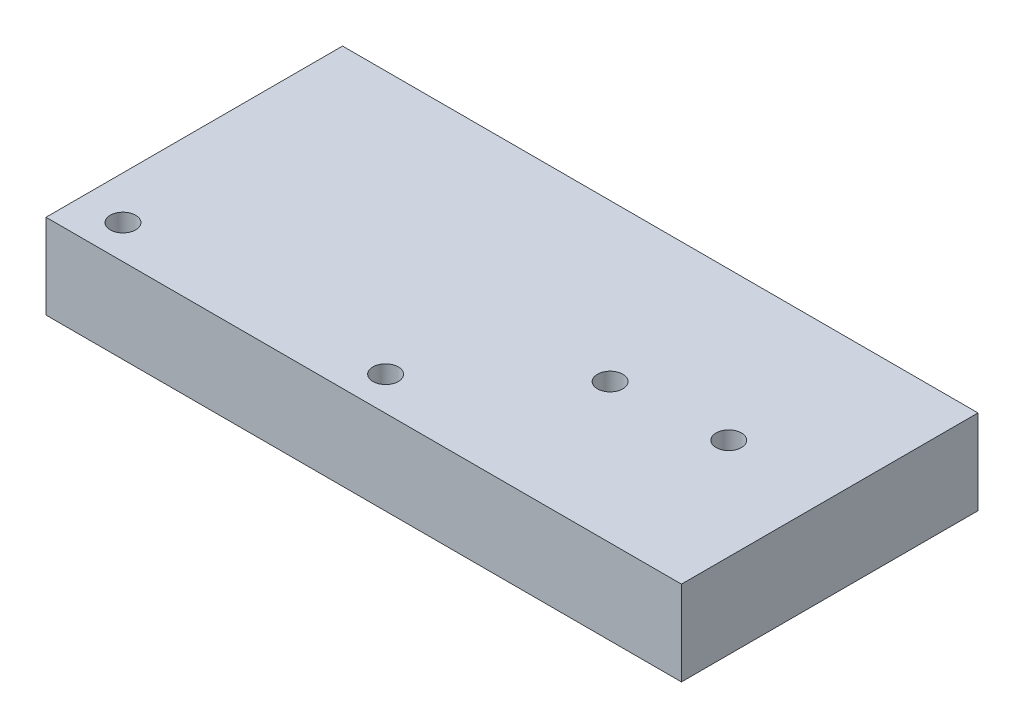
from build123d import *

# Parameters (mm, degrees)
SKETCH1_W           = 150
SKETCH1_H           = 70
BOSS_EXTRUDE1_DEPTH = 10
SKETCH2_R           = 3
CUT_EXTRUDE1_DEPTH  = 86.14693183


with BuildPart() as part:
    # Sketch1 → Boss-Extrude1 (new, symmetric)
    with BuildSketch(Plane(origin=(0, 0, 0), x_dir=(1, 0, 0), z_dir=(0, 1, 0))):
        Rectangle(SKETCH1_W, SKETCH1_H)
    extrude(amount=BOSS_EXTRUDE1_DEPTH, both=True)

    # Sketch2 → Cut-Extrude1 (cut, through all)
    with BuildSketch(Plane(origin=(0, 10, 0), x_dir=(1, 0, 0), z_dir=(0, 1, 0))):
        with Locations(Location((-64.830640928, -27, 0), (0, 0, 270))):
            Circle(SKETCH2_R)
        with Locations(Location((-2.830640928, -27, 0), (0, 0, 270))):
            Circle(SKETCH2_R)
        with Locations(Location((25.169359072, -2, 0), (0, 0, 270))):
            Circle(SKETCH2_R)
        with Locations(Location((51.169359072, 0, 0), (0, 0, 270))):
            Circle(SKETCH2_R)
    extrude(amount=-CUT_EXTRUDE1_DEPTH, mode=Mode.SUBTRACT)


solid = part.part
